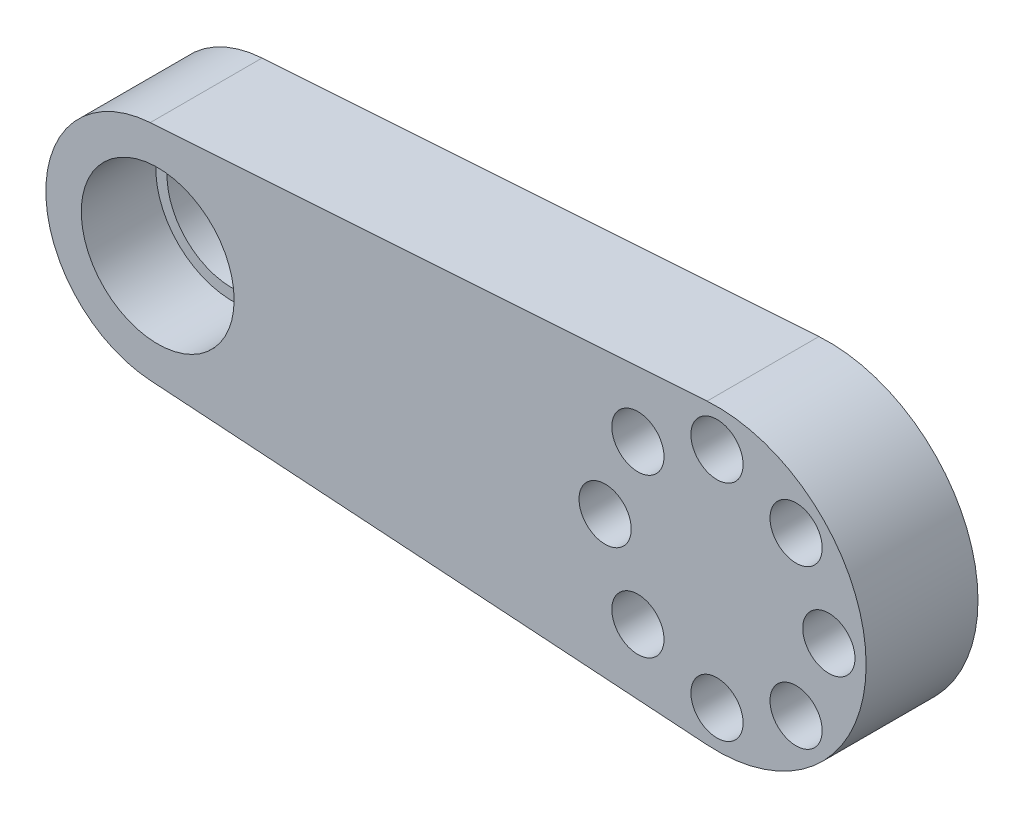
from build123d import *

# Parameters (mm, degrees)
EXTRUDE_1_DEPTH          = 6
CUT_EXTRUDE_1_DEPTH      = 38.363083385
CUT_EXTRUDE_1_DEPTH_BACK = 38.363083385
SKETCH_2_R               = 1.4
SKETCH_3_R               = 4.1
CUT_EXTRUDE_2_DEPTH      = 1.2
SKETCH_4_R               = 4.1
CUT_EXTRUDE_3_DEPTH      = 4
SKETCH_5_R               = 3.5
CUT_EXTRUDE_5_DEPTH      = 38.363083385


with BuildPart() as part:
    # ｽｹｯﾁ1 → ﾎﾞｽ - 押し出し1 (new body)
    with BuildSketch(Plane.XY):
        with BuildLine():
            Line((-0.533333333, 7.982202425), (-30.4, 5.986651819))
            ThreePointArc((-30.4, 5.986651819), (-36, 0), (-30.4, -5.986651819))
            Line((-30.4, -5.986651819), (-0.533333333, -7.982202425))
            ThreePointArc((-0.533333333, -7.982202425), (8, 0), (-0.533333333, 7.982202425))
        make_face()
    extrude(amount=EXTRUDE_1_DEPTH)

    # ｽｹｯﾁ2 → ｶｯﾄ - 押し出し1 (cut, two sides: drawn at the far end of the back side and taken through both)
    with BuildSketch(Plane.XY.offset(-CUT_EXTRUDE_1_DEPTH_BACK)):
        with Locations((-4.242640687, 4.242640687)):
            Circle(SKETCH_2_R)
        with Locations((6, 0)):
            Circle(SKETCH_2_R)
        with Locations((0, 6)):
            Circle(SKETCH_2_R)
        with Locations((-6, 0)):
            Circle(SKETCH_2_R)
        with Locations((-4.242640687, -4.242640687)):
            Circle(SKETCH_2_R)
        with Locations((0, -6)):
            Circle(SKETCH_2_R)
        with Locations((4.242640687, -4.242640687)):
            Circle(SKETCH_2_R)
        with Locations((4.242640687, 4.242640687)):
            Circle(SKETCH_2_R)
    extrude(amount=CUT_EXTRUDE_1_DEPTH + CUT_EXTRUDE_1_DEPTH_BACK, mode=Mode.SUBTRACT)

    # ｽｹｯﾁ3 → ｶｯﾄ - 押し出し2 (cut)
    with BuildSketch(Plane(origin=(0, 0, 0), x_dir=(-1, 0, 0), z_dir=(0, 0, -1))):
        Circle(SKETCH_3_R)
    extrude(amount=-CUT_EXTRUDE_2_DEPTH, mode=Mode.SUBTRACT)

    # ｽｹｯﾁ4 → ｶｯﾄ - 押し出し3 (cut)
    with BuildSketch(Plane.XY.offset(6)):
        with Locations((-30, 0)):
            Circle(SKETCH_4_R)
    extrude(amount=-CUT_EXTRUDE_3_DEPTH, mode=Mode.SUBTRACT)

    # ｽｹｯﾁ5 → ｶｯﾄ - 押し出し5 (cut, through all)
    with BuildSketch(Plane.XY.offset(6)):
        with Locations((-30, 0)):
            Circle(SKETCH_5_R)
    extrude(amount=-CUT_EXTRUDE_5_DEPTH, mode=Mode.SUBTRACT)


solid = part.part
